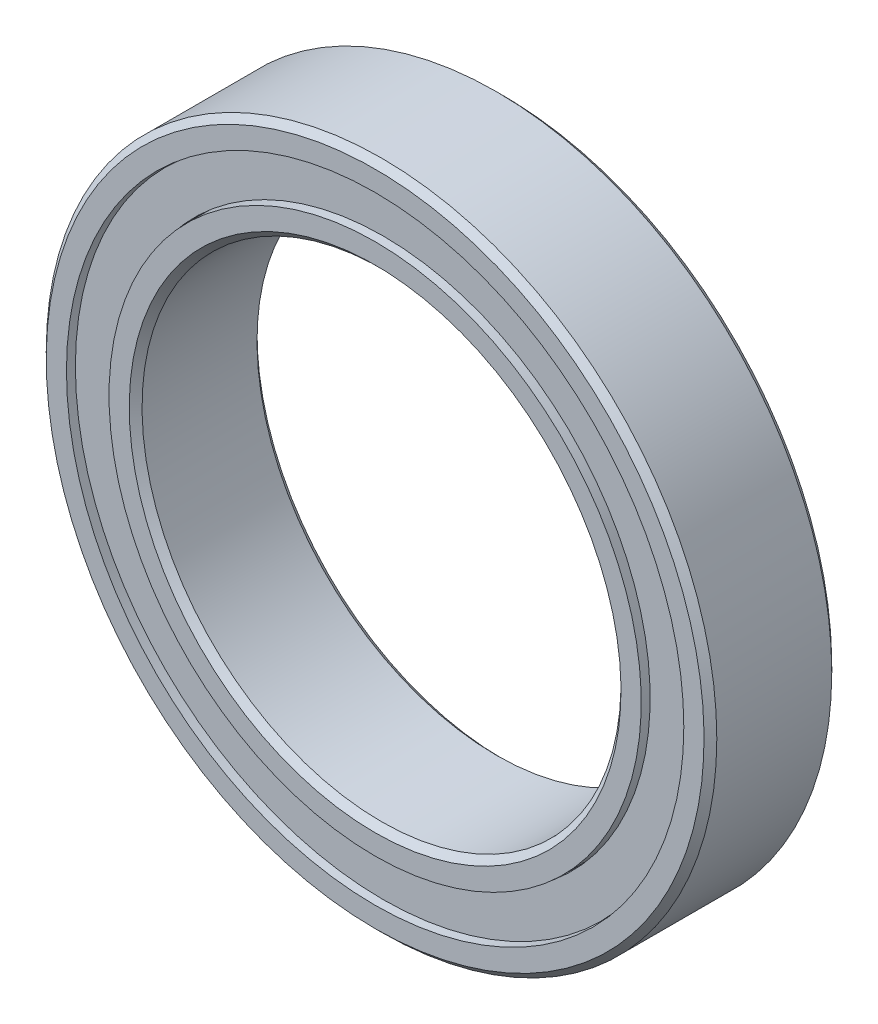
from build123d import *

# Parameters (mm, degrees)
SKETCH5_W         = 0.381
SKETCH5_H         = 1.282533334
CIRPATTERN1_COUNT = 14


with BuildPart() as part:
    # Sketch5 → Revolve1 (revolve)
    with BuildSketch(Plane(origin=(0, 0, 0), x_dir=(0, 0, -1), z_dir=(1, 0, 0)), mode=Mode.PRIVATE) as revolve1_sk:
        with BuildLine():
            Line((1.8, 10.5), (-1.8, 10.5))
            Line((-1.8, 10.5), (-2, 10.3))
            Line((-2, 10.3), (-2, 9.666666667))
            Line((-2, 9.666666667), (-0.888888889, 9.666666667))
            ThreePointArc((-0.888888889, 9.666666667), (0, 10.111111111), (0.888888889, 9.666666667))
            Line((0.888888889, 9.666666667), (2, 9.666666667))
            Line((2, 9.666666667), (2, 10.3))
            Line((2, 10.3), (1.8, 10.5))
        make_face()
        with Locations((1.555555556, 9)):
            Rectangle(SKETCH5_W, SKETCH5_H)
        with Locations((-1.555555556, 9)):
            Rectangle(SKETCH5_W, SKETCH5_H)
    revolve(revolve1_sk.sketch.rotate(Axis((0, 0, 2), (0, 0, -1)), 180), axis=Axis((0, 0, 2), (0, 0, -1)))


with BuildPart() as body_2:
    # Sketch3 → Revolve3 (revolve)
    with BuildSketch(Plane(origin=(0, 0, 0), x_dir=(0, 0, -1), z_dir=(1, 0, 0)), mode=Mode.PRIVATE) as revolve3_sk:
        with BuildLine():
            Line((-2, 8.333333333), (-0.888888889, 8.333333333))
            ThreePointArc((-0.888888889, 8.333333333), (0, 7.888888889), (0.888888889, 8.333333333))
            Line((0.888888889, 8.333333333), (2, 8.333333333))
            Line((2, 8.333333333), (2, 7.7))
            Line((2, 7.7), (1.8, 7.5))
            Line((1.8, 7.5), (-1.8, 7.5))
            Line((-1.8, 7.5), (-2, 7.7))
            Line((-2, 7.7), (-2, 8.333333333))
        make_face()
    revolve(revolve3_sk.sketch.rotate(Axis((0, 0, 2), (0, 0, -1)), 180), axis=Axis((0, 0, 2), (0, 0, -1)))


with BuildPart() as body_3:
    # Sketch4 → Revolve4 (revolve)
    with BuildSketch(Plane(origin=(0, 0, 0), x_dir=(0, 0, -1), z_dir=(1, 0, 0))):
        with BuildLine():
            Line((-1.111111111, 9), (1.111111111, 9))
            ThreePointArc((1.111111111, 9), (0, 10.111111111), (-1.111111111, 9))
        make_face()
    revolve(axis=Axis((0, 9, 1.111111111), (0, 0, -1)))


with BuildPart() as cirpattern1_1:
    # CirPattern1: pattern copy
    add(body_3.part.rotate(Axis((0, 0, 0), (0, 0, 1)), 1 * 360 / CIRPATTERN1_COUNT))


with BuildPart() as cirpattern1_2:
    # CirPattern1: pattern copy
    add(body_3.part.rotate(Axis((0, 0, 0), (0, 0, 1)), 2 * 360 / CIRPATTERN1_COUNT))


with BuildPart() as cirpattern1_3:
    # CirPattern1: pattern copy
    add(body_3.part.rotate(Axis((0, 0, 0), (0, 0, 1)), 3 * 360 / CIRPATTERN1_COUNT))


with BuildPart() as cirpattern1_4:
    # CirPattern1: pattern copy
    add(body_3.part.rotate(Axis((0, 0, 0), (0, 0, 1)), 4 * 360 / CIRPATTERN1_COUNT))


with BuildPart() as cirpattern1_5:
    # CirPattern1: pattern copy
    add(body_3.part.rotate(Axis((0, 0, 0), (0, 0, 1)), 5 * 360 / CIRPATTERN1_COUNT))


with BuildPart() as cirpattern1_6:
    # CirPattern1: pattern copy
    add(body_3.part.rotate(Axis((0, 0, 0), (0, 0, 1)), 6 * 360 / CIRPATTERN1_COUNT))


with BuildPart() as cirpattern1_7:
    # CirPattern1: pattern copy
    add(body_3.part.rotate(Axis((0, 0, 0), (0, 0, 1)), 7 * 360 / CIRPATTERN1_COUNT))


with BuildPart() as cirpattern1_8:
    # CirPattern1: pattern copy
    add(body_3.part.rotate(Axis((0, 0, 0), (0, 0, 1)), 8 * 360 / CIRPATTERN1_COUNT))


with BuildPart() as cirpattern1_9:
    # CirPattern1: pattern copy
    add(body_3.part.rotate(Axis((0, 0, 0), (0, 0, 1)), 9 * 360 / CIRPATTERN1_COUNT))


with BuildPart() as cirpattern1_10:
    # CirPattern1: pattern copy
    add(body_3.part.rotate(Axis((0, 0, 0), (0, 0, 1)), 10 * 360 / CIRPATTERN1_COUNT))


with BuildPart() as cirpattern1_11:
    # CirPattern1: pattern copy
    add(body_3.part.rotate(Axis((0, 0, 0), (0, 0, 1)), 11 * 360 / CIRPATTERN1_COUNT))


with BuildPart() as cirpattern1_12:
    # CirPattern1: pattern copy
    add(body_3.part.rotate(Axis((0, 0, 0), (0, 0, 1)), 12 * 360 / CIRPATTERN1_COUNT))


with BuildPart() as cirpattern1_13:
    # CirPattern1: pattern copy
    add(body_3.part.rotate(Axis((0, 0, 0), (0, 0, 1)), 13 * 360 / CIRPATTERN1_COUNT))


solid = Compound([part.part, body_2.part, body_3.part, cirpattern1_1.part, cirpattern1_2.part, cirpattern1_3.part, cirpattern1_4.part, cirpattern1_5.part, cirpattern1_6.part, cirpattern1_7.part, cirpattern1_8.part, cirpattern1_9.part, cirpattern1_10.part, cirpattern1_11.part, cirpattern1_12.part, cirpattern1_13.part])
